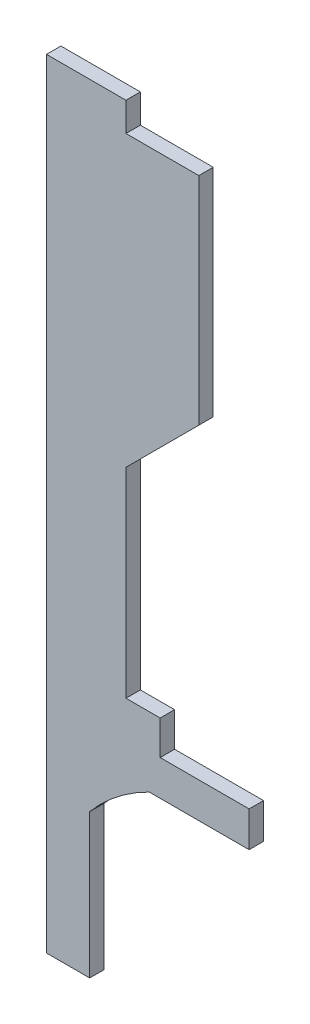
from build123d import *

# Parameters (mm, degrees)
BOSS_EXTRU_1_DEPTH = 5


with BuildPart() as part:
    # Esquisse1 → Boss.-Extru.1 (new body)
    with BuildSketch(Plane.XY):
        with BuildLine():
            Line((70.297192809, 66.186397284), (70.297192809, 78.451204868))
            Line((70.297192809, 78.451204868), (39.439293445, 78.451204868))
            Line((39.439293445, 78.451204868), (39.439293445, 90.333987182))
            Line((39.439293445, 90.333987182), (27.572537656, 90.333987182))
            Line((27.572537656, 90.333987182), (27.572537656, 159.717501023))
            Line((27.572537656, 159.717501023), (52.855036633, 185))
            Line((52.855036633, 185), (52.855036633, 260))
            Line((52.855036633, 260), (27.572537656, 260))
            Line((27.572537656, 260), (27.572537656, 270))
            Line((27.572537656, 270), (0, 270))
            Line((0, 270), (0, 0))
            Line((0, 0), (15, 0))
            Line((15, 0), (15, 50))
            ThreePointArc((15, 50), (24.488558001, 59.174106779), (35.670004688, 66.186397284))
            Line((35.670004688, 66.186397284), (70.297192809, 66.186397284))
        make_face()
    extrude(amount=BOSS_EXTRU_1_DEPTH)


solid = part.part
